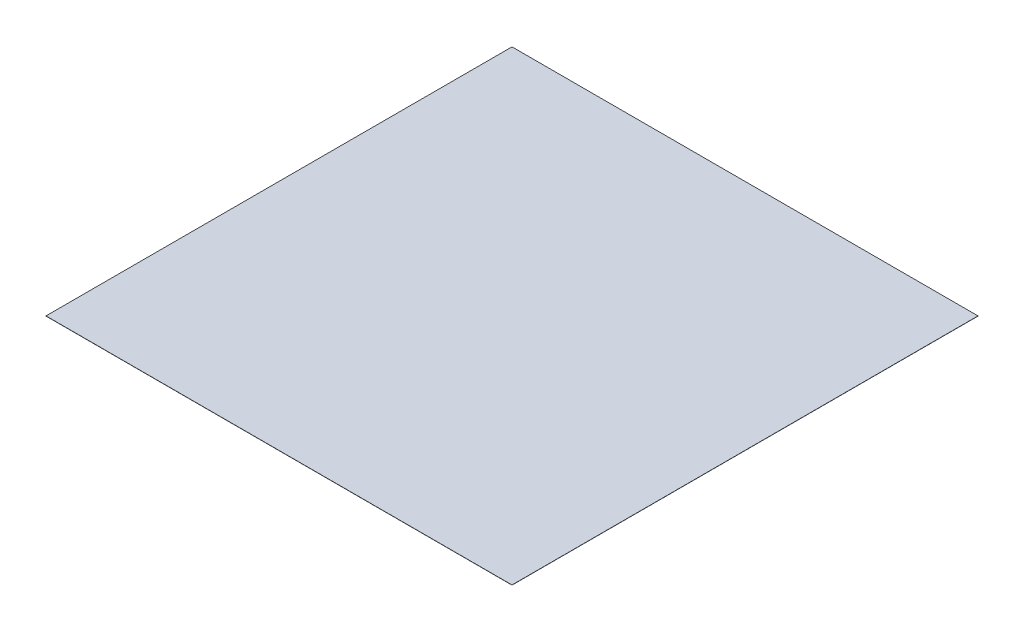
from build123d import *

# Parameters (mm, degrees)
SKETCH1_W           = 5000
SKETCH1_H           = 5000
BOSS_EXTRUDE1_DEPTH = 2


with BuildPart() as part:
    # Sketch1 → Boss-Extrude1 (new body)
    with BuildSketch(Plane(origin=(0, 0, 0), x_dir=(1, 0, 0), z_dir=(0, 1, 0))):
        Rectangle(SKETCH1_W, SKETCH1_H)
    extrude(amount=BOSS_EXTRUDE1_DEPTH)


solid = part.part
